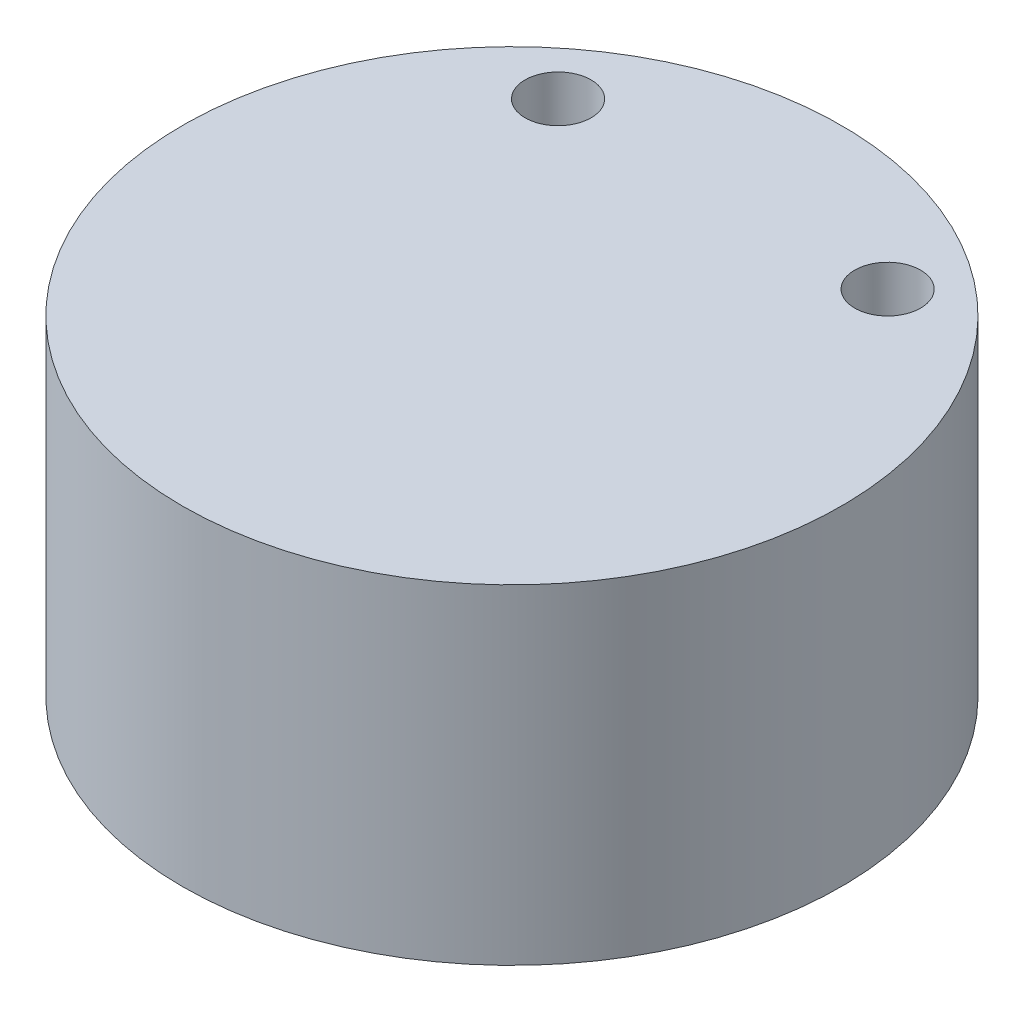
from build123d import *

# Parameters (mm, degrees)
SKETCH1_R           = 3.96875
BOSS_EXTRUDE1_DEPTH = 3.96875
SKETCH2_R           = 0.396875
CUT_EXTRUDE1_DEPTH  = 7.874076643


with BuildPart() as part:
    # Sketch1 → Boss-Extrude1 (new body)
    with BuildSketch(Plane(origin=(0, 0, 0), x_dir=(1, 0, 0), z_dir=(0, 1, 0))):
        with Locations(Location((0, 0, 0), (0, 0, 270))):
            Circle(SKETCH1_R)
    extrude(amount=BOSS_EXTRUDE1_DEPTH)

    # Sketch2 → Cut-Extrude1 (cut, through all)
    with BuildSketch(Plane.XZ):
        with Locations(Location((1.984375, -2.54, 0), (0, 0, 270))):
            Circle(SKETCH2_R)
        with Locations(Location((-1.984375, -2.54, 0), (0, 0, 270))):
            Circle(SKETCH2_R)
    extrude(amount=-CUT_EXTRUDE1_DEPTH, mode=Mode.SUBTRACT)


solid = part.part
